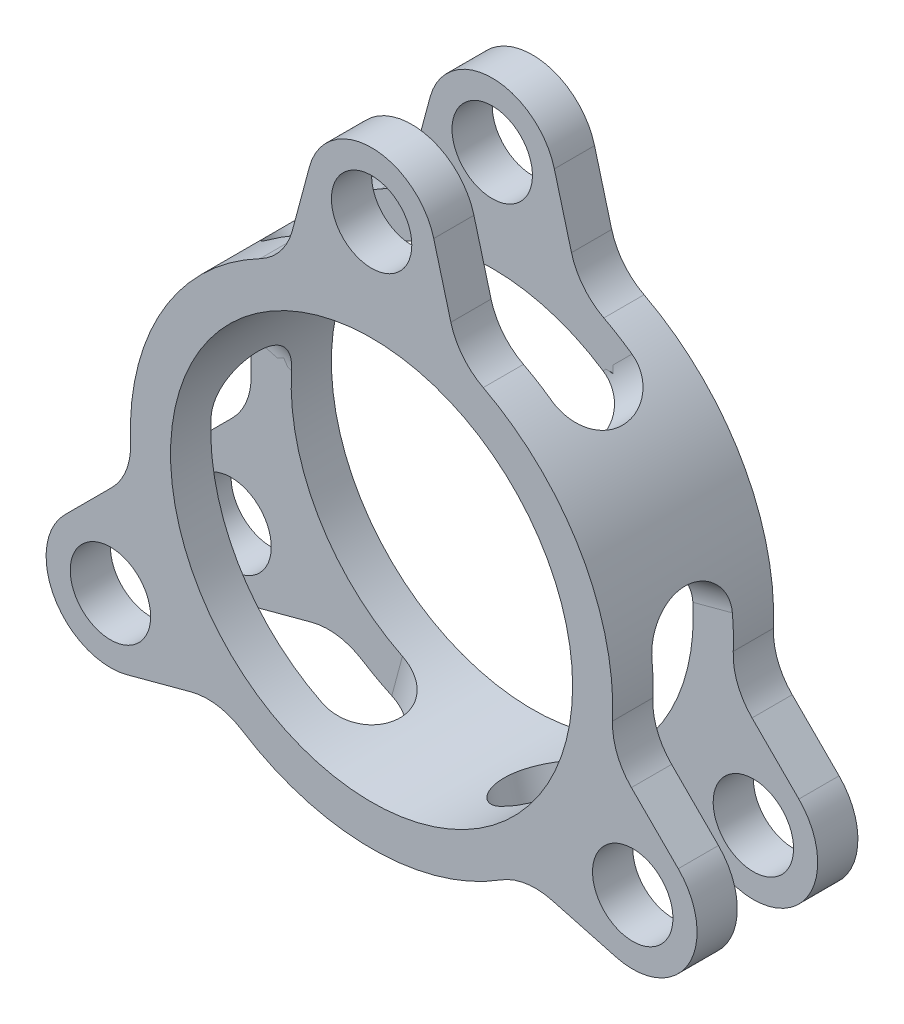
from build123d import *

# Parameters (mm, degrees)
SKETCH1_R           = 25
SKETCH1_R_2         = 5
BOSS_EXTRUDE1_DEPTH = 20
CUT_EXTRUDE2_DEPTH  = 65.097993278
CUT_EXTRUDE5_DEPTH  = 65.09799338
SKETCH17_W          = 27.497524216
SKETCH17_H          = 10
CUT_EXTRUDE7_DEPTH  = 69.272212154
CIRPATTERN1_COUNT   = 3


with BuildPart() as part:
    # Sketch1 → Boss-Extrude1 (new body)
    with BuildSketch(Plane.XY):
        with BuildLine():
            Line((-7.72740661, 39.570552361), (-9.859096528, 31.614977283))
            ThreePointArc((-9.859096528, 31.614977283), (-11.344452128, 28.681851078), (-13.884081425, 26.593839192))
            ThreePointArc((-13.884081425, 26.593839192), (-25.980762114, 15), (-29.972981037, -1.272952374))
            ThreePointArc((-29.972981037, -1.272952374), (-30.511437725, -4.516341804), (-32.308921731, -7.26926059))
            Line((-32.308921731, -7.26926059), (-38.132806891, -13.093145751))
            ThreePointArc((-38.132806891, -13.093145751), (-39.404155872, -22.75), (-30.405400281, -26.47740661))
            Line((-30.405400281, -26.47740661), (-22.449825203, -24.345716693))
            ThreePointArc((-22.449825203, -24.345716693), (-19.166985597, -24.165509274), (-16.088899612, -25.320886818))
            ThreePointArc((-16.088899612, -25.320886818), (0, -30), (16.088899612, -25.320886818))
            ThreePointArc((16.088899612, -25.320886818), (19.166985597, -24.165509274), (22.449825203, -24.345716693))
            Line((22.449825203, -24.345716693), (30.405400281, -26.47740661))
            ThreePointArc((30.405400281, -26.47740661), (39.404155872, -22.75), (38.132806891, -13.093145751))
            Line((38.132806891, -13.093145751), (32.308921731, -7.26926059))
            ThreePointArc((32.308921731, -7.26926059), (30.511437725, -4.516341804), (29.972981037, -1.272952374))
            ThreePointArc((29.972981037, -1.272952374), (25.980762114, 15), (13.884081425, 26.593839192))
            ThreePointArc((13.884081425, 26.593839192), (11.344452128, 28.681851078), (9.859096528, 31.614977283))
            Line((9.859096528, 31.614977283), (7.72740661, 39.570552361))
            ThreePointArc((7.72740661, 39.570552361), (0, 45.5), (-7.72740661, 39.570552361))
        make_face()
        Circle(SKETCH1_R, mode=Mode.SUBTRACT)
        with Locations((0, 37.5)):
            Circle(SKETCH1_R_2, mode=Mode.SUBTRACT)
        with Locations((32.475952642, -18.75)):
            Circle(SKETCH1_R_2, mode=Mode.SUBTRACT)
        with Locations((-32.475952642, -18.75)):
            Circle(SKETCH1_R_2, mode=Mode.SUBTRACT)
    extrude(amount=BOSS_EXTRUDE1_DEPTH)

    # Sketch14 → Cut-Extrude2 (cut, through all)
    with BuildSketch(Plane(origin=(0, 0, 0), x_dir=(-0.7071067811865461, 0.707106781186549, 0), z_dir=(-0.707106781186549, -0.7071067811865461, 0))):
        with BuildLine():
            Line((19.111501151, -15), (5, -15))
            ThreePointArc((5, -15), (0, -10), (5, -5))
            Line((5, -5), (19.111501151, -5))
            ThreePointArc((19.111501151, -5), (24.111501151, -10), (19.111501151, -15))
        make_face()
    cut_extrude2 = extrude(amount=-CUT_EXTRUDE2_DEPTH, mode=Mode.SUBTRACT)

    # Sketch15 → Cut-Extrude5 (cut, through all)
    with BuildSketch(Plane(origin=(0, 0, 0), x_dir=(0.7071067811865489, 0.7071067811865462, 0), z_dir=(-0.7071067811865462, 0.7071067811865489, 0))):
        with BuildLine():
            Line((17.551379006, -15), (5, -15))
            ThreePointArc((5, -15), (0, -10), (5, -5))
            Line((5, -5), (17.551379006, -5))
            ThreePointArc((17.551379006, -5), (22.551379006, -10), (17.551379006, -15))
        make_face()
    cut_extrude5 = extrude(amount=CUT_EXTRUDE5_DEPTH, mode=Mode.SUBTRACT)

    # Sketch17 → Cut-Extrude7 (cut, through all)
    with BuildSketch(Plane(origin=(0, 21.213203436, 0), x_dir=(-1, 0, 0), z_dir=(0, -1, 0))):
        with Locations((-1.299865662, -10)):
            Rectangle(SKETCH17_W, SKETCH17_H)
    cut_extrude7 = extrude(amount=-CUT_EXTRUDE7_DEPTH, mode=Mode.SUBTRACT)

    # CirPattern1: Cut-Extrude2, Cut-Extrude5, Cut-Extrude7 ×3 about axis
    cirpattern1_axis = Axis((0, 0, 0), (0, 0, 1))
    add([cut_extrude2.rotate(cirpattern1_axis, i * 360 / CIRPATTERN1_COUNT) for i in range(1, CIRPATTERN1_COUNT)], mode=Mode.SUBTRACT)
    add([cut_extrude5.rotate(cirpattern1_axis, i * 360 / CIRPATTERN1_COUNT) for i in range(1, CIRPATTERN1_COUNT)], mode=Mode.SUBTRACT)
    add([cut_extrude7.rotate(cirpattern1_axis, i * 360 / CIRPATTERN1_COUNT) for i in range(1, CIRPATTERN1_COUNT)], mode=Mode.SUBTRACT)


solid = part.part
